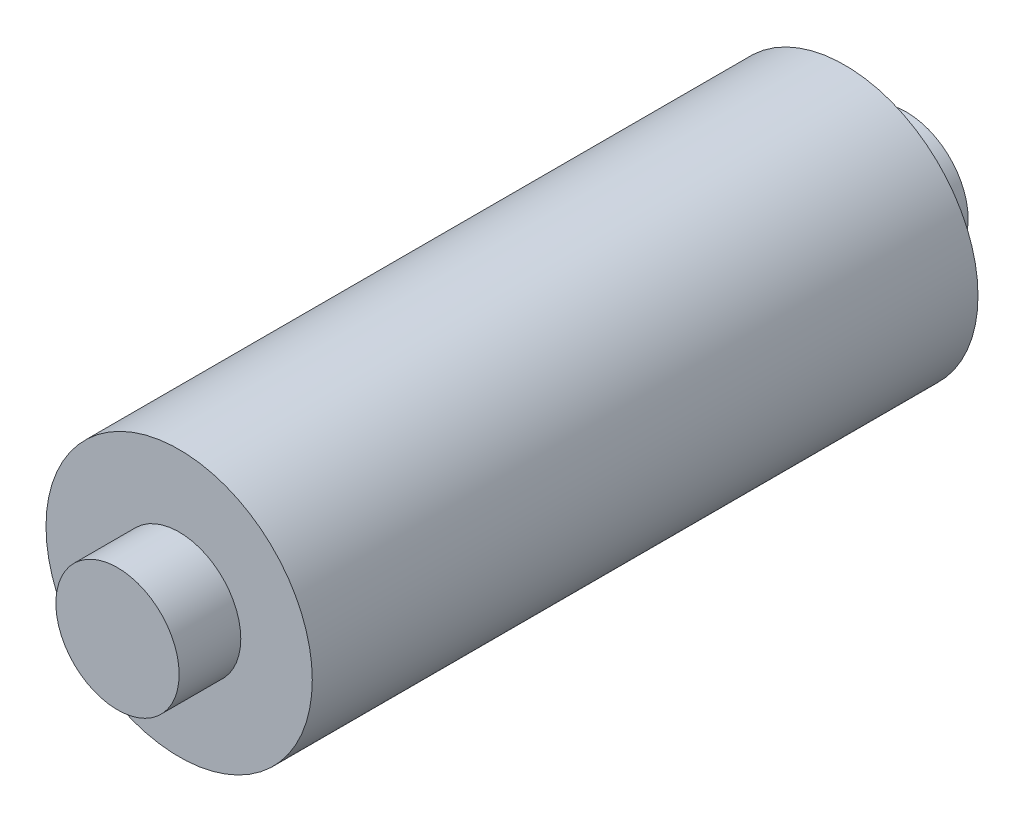
from build123d import *

# Parameters (mm, degrees)
SKETCH_1_R      = 54
EXTRUDE_1_DEPTH = 270
SKETCH_2_R      = 25
EXTRUDE_2_DEPTH = 25
EXTRUDE_START   = 25
SKETCH_3_R      = 25
EXTRUDE_3_DEPTH = 25


with BuildPart() as part:
    # 草图1 → 凸台-拉伸1 (new body)
    with BuildSketch(Plane.XY):
        Circle(SKETCH_1_R)
    extrude(amount=EXTRUDE_1_DEPTH)

    # 草图2 → 凸台-拉伸2 (add)
    with BuildSketch(Plane.XY.offset(270)):
        Circle(SKETCH_2_R)
    extrude(amount=EXTRUDE_2_DEPTH)

    # 草图3 → 凸台-拉伸3 (add)
    with BuildSketch(Plane(origin=(0, 0, 0), x_dir=(-1, 0, 0), z_dir=(0, 0, -1)).offset(EXTRUDE_START)):
        with Locations(Location((0, 0, 0), (0, 0, 180))):
            Circle(SKETCH_3_R)
    extrude(amount=-EXTRUDE_3_DEPTH)


solid = part.part
